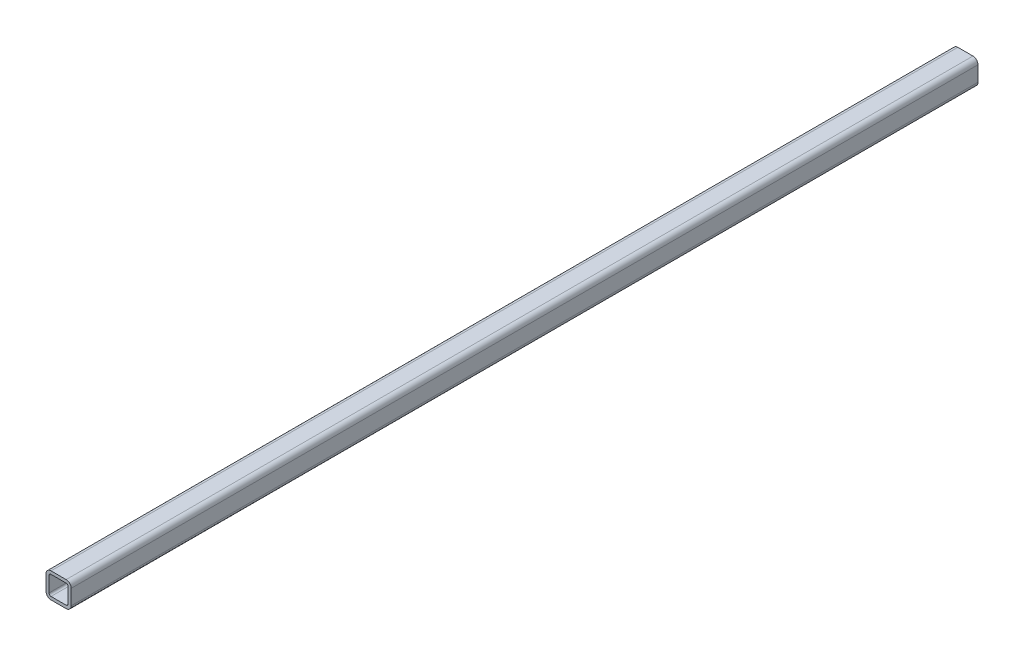
from build123d import *

# Parameters (mm, degrees)
BOSS_EXTRUDE1_DEPTH = 900


with BuildPart() as part:
    # Sketch1 → Boss-Extrude1 (new body)
    with BuildSketch(Plane.XY):
        with BuildLine():
            Line((-7.5, -12.5), (7.5, -12.5))
            ThreePointArc((7.5, -12.5), (11.035533906, -11.035533906), (12.5, -7.5))
            Line((12.5, -7.5), (12.5, 7.5))
            ThreePointArc((12.5, 7.5), (11.035533906, 11.035533906), (7.5, 12.5))
            Line((7.5, 12.5), (-7.5, 12.5))
            ThreePointArc((-7.5, 12.5), (-11.035533906, 11.035533906), (-12.5, 7.5))
            Line((-12.5, 7.5), (-12.5, -7.5))
            ThreePointArc((-12.5, -7.5), (-11.035533906, -11.035533906), (-7.5, -12.5))
        make_face()
        with BuildLine():
            Line((-9.5, 7.5), (-9.5, -7.5))
            ThreePointArc((-9.5, -7.5), (-8.914213562, -8.914213562), (-7.5, -9.5))
            Line((-7.5, -9.5), (7.5, -9.5))
            ThreePointArc((7.5, -9.5), (8.914213562, -8.914213562), (9.5, -7.5))
            Line((9.5, -7.5), (9.5, 7.5))
            ThreePointArc((9.5, 7.5), (8.914213562, 8.914213562), (7.5, 9.5))
            Line((7.5, 9.5), (-7.5, 9.5))
            ThreePointArc((-7.5, 9.5), (-8.914213562, 8.914213562), (-9.5, 7.5))
        make_face(mode=Mode.SUBTRACT)
    extrude(amount=BOSS_EXTRUDE1_DEPTH)


solid = part.part
